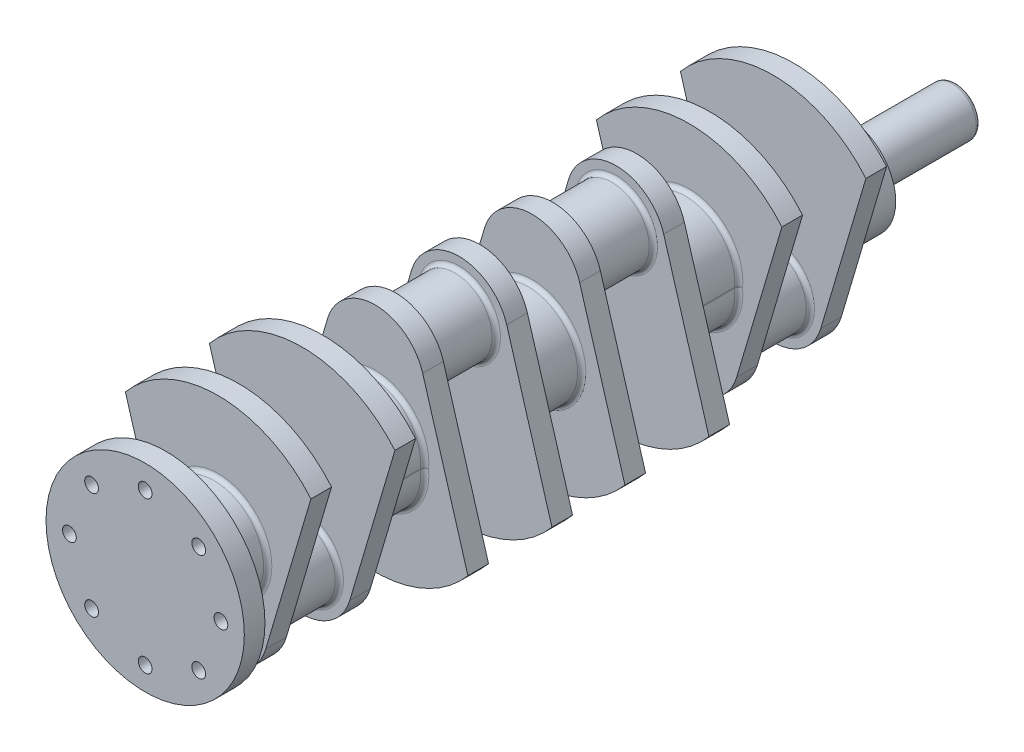
from build123d import *

# Parameters (mm, degrees)
SKETCH1_R             = 36
BOSS_EXTRUDE1_DEPTH   = 15
SKETCH2_R             = 27
BOSS_EXTRUDE2_DEPTH   = 46
SKETCH3_R             = 36
BOSS_EXTRUDE3_DEPTH   = 38
BODY_MOVE_COPY1_ANGLE = 180
SKETCH4_R             = 17.5
BOSS_EXTRUDE4_DEPTH   = 80
SKETCH5_R             = 72
SKETCH5_R_2           = 5
BOSS_EXTRUDE5_DEPTH   = 15
FILLET1_R             = 3


with BuildPart() as part:
    # Sketch1 → Boss-Extrude1 (new body)
    with BuildSketch(Plane.XY):
        with BuildLine():
            Line((-67.355024071, 56.633035698), (-34.517510455, -54.224552409))
            ThreePointArc((-34.517510455, -54.224552409), (-5.165734392, -8.372550074), (36, -44))
            ThreePointArc((36, -44), (35.627449926, -49.165734392), (34.517510455, -54.224552409))
            Line((34.517510455, -54.224552409), (67.355024071, 56.633035698))
            ThreePointArc((67.355024071, 56.633035698), (0, 88), (-67.355024071, 56.633035698))
        make_face()
        with Locations((0, -44)):
            Circle(SKETCH1_R)
    boss_extrude1 = extrude(amount=BOSS_EXTRUDE1_DEPTH)

    # Sketch2 → Boss-Extrude2 (add)
    with BuildSketch(Plane(origin=(0, 0, 0), x_dir=(-1, 0, 0), z_dir=(0, 0, -1))):
        with Locations(Location((0, -44, 0), (0, 0, 180))):
            Circle(SKETCH2_R)
    extrude(amount=BOSS_EXTRUDE2_DEPTH)

    # Sketch3 → Boss-Extrude3 (add)
    with BuildSketch(Plane.XY.offset(15)):
        Circle(SKETCH3_R)
    boss_extrude3 = extrude(amount=BOSS_EXTRUDE3_DEPTH)

    # Mirror1: Boss-Extrude1, Boss-Extrude3 across plane
    add(boss_extrude1.mirror(Plane(origin=(0, 0, -23), x_dir=(1, 0, 0), z_dir=(0, 0, -1))))
    add(boss_extrude3.mirror(Plane(origin=(0, 0, -23), x_dir=(1, 0, 0), z_dir=(0, 0, -1))))


with BuildPart() as body_2:
    # Mirror12: mirrored copy
    add(part.part.mirror(Plane(origin=(0, 0, -80), x_dir=(1, 0, 0), z_dir=(0, 0, -1))))


with BuildPart() as body_2_1:
    # Body-Move/Copy1: moved
    add(body_2.part.rotate(Axis((0, 4, -137), (1, 0, 0)), BODY_MOVE_COPY1_ANGLE))


with BuildPart() as body_3:
    # Mirror13: mirrored copy
    add(part.part.mirror(Plane(origin=(0, 0, -194), x_dir=(1, 0, 0), z_dir=(0, 0, -1))))

    # Sketch4 → Boss-Extrude4 (add)
    with BuildSketch(Plane(origin=(0, 0, -441), x_dir=(-1, 0, 0), z_dir=(0, 0, -1))):
        with Locations(Location((0, 0, 0), (0, 0, 90))):
            Circle(SKETCH4_R)
    extrude(amount=BOSS_EXTRUDE4_DEPTH)


with BuildPart() as body_4:
    # Mirror13 2: mirrored copy
    add(body_2_1.part.mirror(Plane(origin=(0, 0, -194), x_dir=(1, 0, 0), z_dir=(0, 0, -1))))


with BuildPart() as part_1:
    add(part.part)

    # Sketch5 → Boss-Extrude5 (add)
    with BuildSketch(Plane.XY.offset(53)):
        Circle(SKETCH5_R)
        with Locations((0, 55)):
            Circle(SKETCH5_R_2, mode=Mode.SUBTRACT)
        with Locations((38.890872965, 38.890872965)):
            Circle(SKETCH5_R_2, mode=Mode.SUBTRACT)
        with Locations((55, 0)):
            Circle(SKETCH5_R_2, mode=Mode.SUBTRACT)
        with Locations((38.890872965, -38.890872965)):
            Circle(SKETCH5_R_2, mode=Mode.SUBTRACT)
        with Locations((0, -55)):
            Circle(SKETCH5_R_2, mode=Mode.SUBTRACT)
        with Locations((-38.890872965, -38.890872965)):
            Circle(SKETCH5_R_2, mode=Mode.SUBTRACT)
        with Locations((-55, 0)):
            Circle(SKETCH5_R_2, mode=Mode.SUBTRACT)
        with Locations((-38.890872965, 38.890872965)):
            Circle(SKETCH5_R_2, mode=Mode.SUBTRACT)
    extrude(amount=BOSS_EXTRUDE5_DEPTH)


with BuildPart() as body_3_1:
    add(body_3.part)

    # Combine1: union body 4, body 2, part
    add(body_4.part)
    add(body_2_1.part)
    add(part_1.part)

    # Fillet1
    fillet1_edges = [body_3_1.edges().sort_by_distance(p)[0] for p in [
        (-27, -44, -388),
        (-27, -44, -342),
        (-36, 0, -403),
        (0, -17.5, -441),
        (0, -17.5, -521),
        (0, -36, -289),
        (0, -36, -327),
        (35.77708764, 4, -308),
        (-35.77708764, 4, -308),
        (-27, 52, -274),
        (0, 44, -289),
        (0, 44, -327),
        (-36, 8, -213),
        (-27, 52, -228),
        (-36, 8, -175),
        (0, 44, -99),
        (-27, 52, -114),
        (-27, 52, -160),
        (-35.77708764, 4, -80),
        (0, 44, -61),
        (35.77708764, 4, -80),
        (0, -36, -99),
        (-27, -44, 0),
        (-36, 0, 15),
        (0, -36, -61),
        (-27, -44, -46),
        (-36, 0, 53),
    ]]
    fillet(fillet1_edges, radius=FILLET1_R)


solid = body_3_1.part
